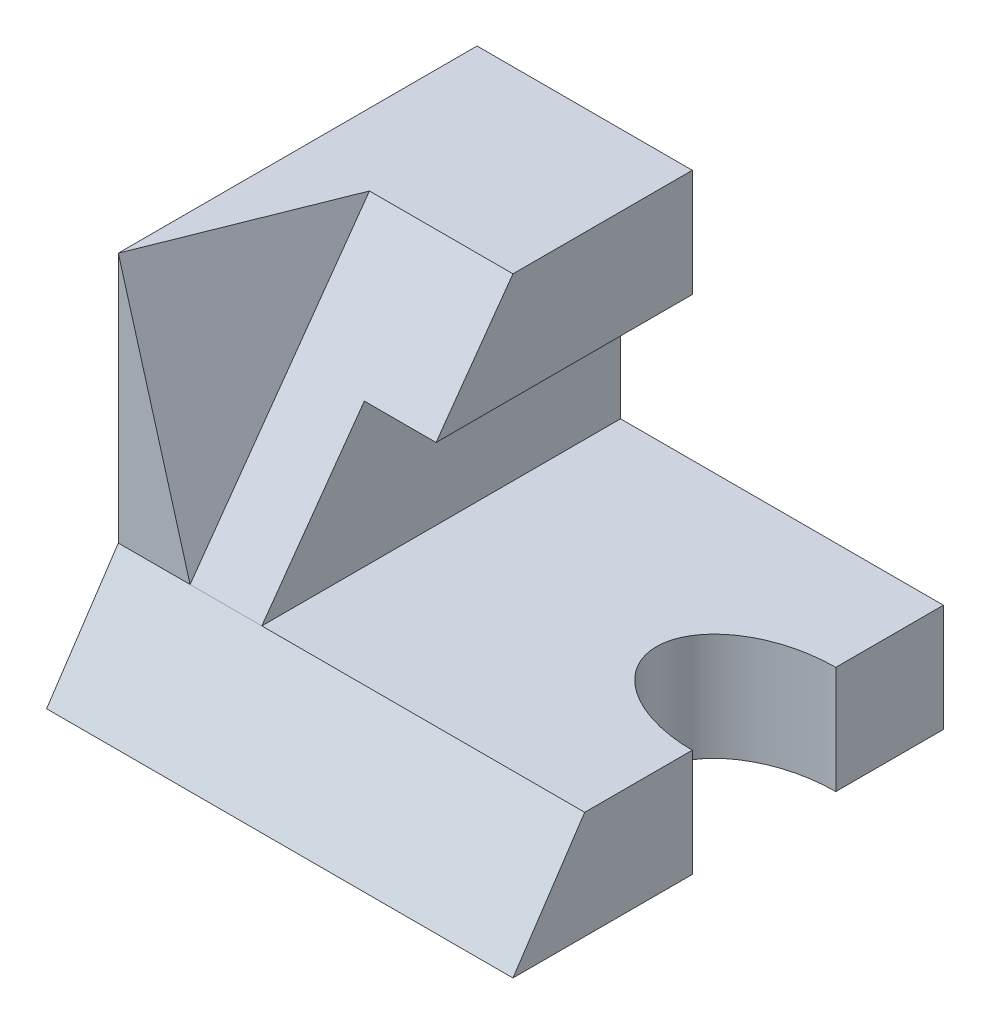
from build123d import *

# Parameters (mm, degrees)
BOSS_EXTRUDE1_DEPTH = 65
BOSS_EXTRUDE2_DEPTH = 20
BOSS_EXTRUDE3_DEPTH = 30
BOSS_EXTRUDE4_DEPTH = 10
CUT_EXTRUDE1_DEPTH  = 10
CUT_EXTRUDE3_REACH  = 97.131
SKETCH3_RX          = 15
SKETCH3_RY          = 10


with BuildPart() as part:
    # Sketch1 → Boss-Extrude1 (new body)
    with BuildSketch(Plane(origin=(0, 0, 0), x_dir=(0, 0, -1), z_dir=(1, 0, 0))):
        Polygon((0, 0), (0, 15), (-50, 15), (-60, 0), align=None)
    extrude(amount=BOSS_EXTRUDE1_DEPTH)

    # Sketch1<3> → Boss-Extrude2 (add)
    with BuildSketch(Plane(origin=(0, 0, 0), x_dir=(0, 0, -1), z_dir=(1, 0, 0))):
        Polygon((-50, 15), (0, 15), (0, 35), (-35.714285714, 35), align=None)
    extrude(amount=BOSS_EXTRUDE2_DEPTH)

    # Sketch1<4> → Boss-Extrude3 (add)
    with BuildSketch(Plane(origin=(0, 0, 0), x_dir=(0, 0, -1), z_dir=(1, 0, 0))):
        Polygon((-35.714285714, 35), (0, 35), (0, 50), (-25, 50), align=None)
    extrude(amount=BOSS_EXTRUDE3_DEPTH)

    # Sketch1<5> → Boss-Extrude4 (add)
    with BuildSketch(Plane(origin=(0, 0, 0), x_dir=(0, 0, -1), z_dir=(1, 0, 0))):
        Polygon((-50, 50), (-50, 15), (-35.714285714, 35), (-25, 50), align=None)
    extrude(amount=BOSS_EXTRUDE4_DEPTH)

    # Sketch2 → Cut-Extrude1 (cut, along a direction that is not the sketch's normal)
    with BuildSketch(Plane(origin=(27.613412229, 7.889546351, 11.045364892), x_dir=(-0.3451624427428596, -0.09861784078367415, 0.9333474217026305), z_dir=(-0.8974358974358975, -0.2564102564102566, -0.358974358974359))):
        Polygon((41.736479046, 48.076197382), (14.951169076, 45.328986103), (41.736479046, 11.675647936), align=None)
    extrude(amount=-CUT_EXTRUDE1_DEPTH, dir=(-1, 0, 0), mode=Mode.SUBTRACT)

    # Sketch3 → Cut-Extrude3 (cut, up to next)
    with BuildSketch(Plane(origin=(0, 15, 0), x_dir=(1, 0, 0), z_dir=(0, 1, 0)), mode=Mode.PRIVATE) as cut_extrude3_sk1:
        with Locations((65, -25)):
            Ellipse(SKETCH3_RX, SKETCH3_RY)
    cut_extrude3_tool1 = extrude(cut_extrude3_sk1.sketch, amount=-CUT_EXTRUDE3_REACH, mode=Mode.PRIVATE) & part.part
    add(cut_extrude3_tool1.solids().sort_by_distance((65, 15, 25))[0], mode=Mode.SUBTRACT)


solid = part.part
